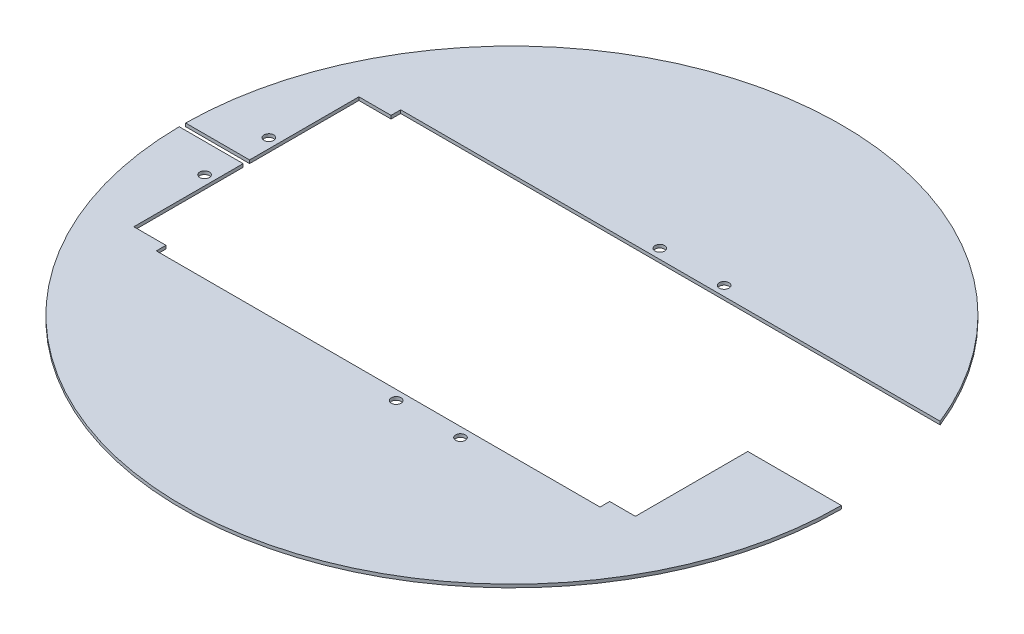
from build123d import *

# Parameters (mm, degrees)
SKETCH_1_R          = 102.5
EXTRUDE_1_DEPTH     = 1
SKETCH_2_W          = 47.933731137
SKETCH_2_H          = 0.1
SKETCH_2_W_2        = 106.787277248
SKETCH_2_H_2        = 2
CUT_EXTRUDE_1_DEPTH = 145.960339404
SKETCH_5_W          = 37.099987805
SKETCH_5_H          = 37.95
CUT_EXTRUDE_4_DEPTH = 145.960330781
SKETCH_6_R          = 1.5
CUT_EXTRUDE_5_DEPTH = 145.960330781


with BuildPart() as part:
    # 草图1 → 凸台-拉伸1 (new body)
    with BuildSketch(Plane(origin=(0, 0, 0), x_dir=(1, 0, 0), z_dir=(0, 1, 0))):
        with Locations(Location((0, 0, 0), (0, 0, 270))):
            Circle(SKETCH_1_R)
        Polygon((-82.6, 35), (-82.6, -35), (-72.6, -35), (-72.6, -38), (65.4, -38), (65.4, -35), (73.4, -35), (73.4, 35), (65.4, 35), (65.4, 38), (-72.6, 38), (-72.6, 35), align=None, mode=Mode.SUBTRACT)
    extrude(amount=EXTRUDE_1_DEPTH)

    # 草图2 → 切除-拉伸1 (cut, through all)
    with BuildSketch(Plane(origin=(0, 1, 0), x_dir=(1, 0, 0), z_dir=(0, 1, 0))):
        with Locations((97.366865569, 0)):
            Rectangle(SKETCH_2_W, SKETCH_2_H)
        with Locations((-135.993638624, 0)):
            Rectangle(SKETCH_2_W_2, SKETCH_2_H_2)
    extrude(amount=-CUT_EXTRUDE_1_DEPTH, mode=Mode.SUBTRACT)


with BuildPart() as cut_extrude_1_piece_1:
    # of the separate pieces the step leaves, piece 1, a body of its own (cut_extrude_1_pieces)
    add(part.part.solids().sort_by_distance((-102.495121835, 0, 1))[0])


with BuildPart() as cut_extrude_1_piece_2:
    # of the separate pieces the step leaves, piece 2, a body of its own (cut_extrude_1_pieces)
    add(part.part.solids().sort_by_distance((102.499987805, 0, -0.05))[0])

    # 草图5 → 切除-拉伸4 (cut, through all)
    with BuildSketch(Plane(origin=(0, 1, 0), x_dir=(1, 0, 0), z_dir=(0, 1, 0))):
        with Locations((83.949993903, 19.025)):
            Rectangle(SKETCH_5_W, SKETCH_5_H)
    extrude(amount=-CUT_EXTRUDE_4_DEPTH, mode=Mode.SUBTRACT)


with BuildPart() as cut_extrude_5_tool:
    # 草图6 → 切除-拉伸5 (new, through all)
    with BuildSketch(Plane(origin=(0, 1, 0), x_dir=(1, 0, 0), z_dir=(0, 1, 0))):
        with Locations(Location((5, 41, 0), (0, 0, 270))):
            Circle(SKETCH_6_R)
        with Locations(Location((25, 41, 0), (0, 0, 90))):
            Circle(SKETCH_6_R)
        with Locations(Location((25, -41, 0), (0, 0, 270))):
            Circle(SKETCH_6_R)
        with Locations(Location((5, -41, 0), (0, 0, 90))):
            Circle(SKETCH_6_R)
        with Locations(Location((-85.6, 10, 0), (0, 0, 270))):
            Circle(SKETCH_6_R)
        with Locations(Location((-85.6, -10, 0), (0, 0, 90))):
            Circle(SKETCH_6_R)
    extrude(amount=-CUT_EXTRUDE_5_DEPTH)


with BuildPart() as cut_extrude_1_piece_1_1:
    add(cut_extrude_1_piece_1.part)

    # 切除-拉伸5: cut by cut_extrude_5_tool
    add(cut_extrude_5_tool.part, mode=Mode.SUBTRACT)


with BuildPart() as cut_extrude_1_piece_2_1:
    add(cut_extrude_1_piece_2.part)

    # 切除-拉伸5: cut by cut_extrude_5_tool
    add(cut_extrude_5_tool.part, mode=Mode.SUBTRACT)


solid = Compound([cut_extrude_1_piece_1_1.part, cut_extrude_1_piece_2_1.part])
